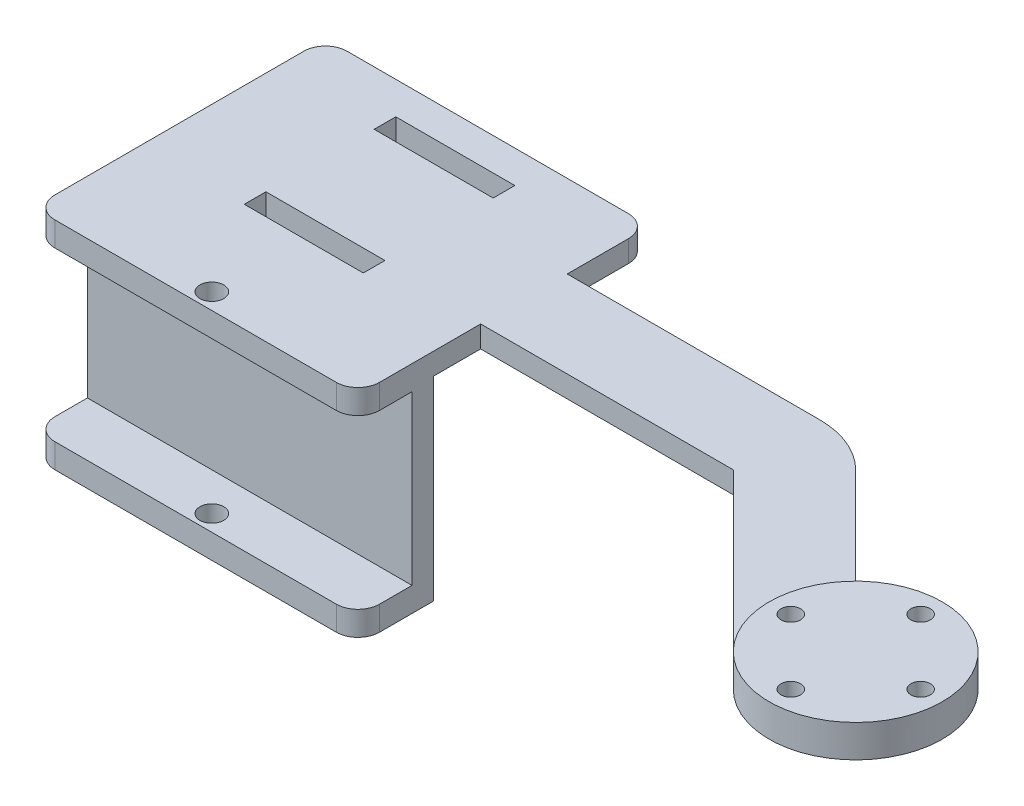
from build123d import *

# Parameters (mm, degrees)
SKETCH_1_W               = 30
SKETCH_1_H               = 7
EXTRUDE_1_DEPTH          = 20
SKETCH_2_W               = 30
SKETCH_2_H               = 15.5
CUT_EXTRUDE_1_DEPTH      = 5
CUT_EXTRUDE_2_DEPTH      = 37.728735344
CUT_EXTRUDE_2_DEPTH_BACK = 37.728735344
SKETCH_4_R               = 1.1
SKETCH_5_W               = 30
SKETCH_5_H               = 2
EXTRUDE_2_DEPTH          = 20
SKETCH_6_W               = 11
SKETCH_6_H               = 2
CUT_EXTRUDE_3_DEPTH      = 2
EXTRUDE_3_DEPTH          = 2
SKETCH_9_R               = 8
EXTRUDE_4_DEPTH          = 3
CUT_EXTRUDE_4_REACH      = 89.509
SKETCH_10_R              = 0.9
FILLET_1_R               = 2


with BuildPart() as part:
    # 草图1 → 凸台-拉伸1 (new body)
    with BuildSketch(Plane(origin=(0, 0, 0), x_dir=(1, 0, 0), z_dir=(0, 1, 0))):
        with Locations((15, -3.5)):
            Rectangle(SKETCH_1_W, SKETCH_1_H)
    extrude(amount=EXTRUDE_1_DEPTH)

    # 草图2 → 切除-拉伸1 (cut)
    with BuildSketch(Plane.XY.offset(7)):
        with Locations((15, 10)):
            Rectangle(SKETCH_2_W, SKETCH_2_H)
    extrude(amount=-CUT_EXTRUDE_1_DEPTH, mode=Mode.SUBTRACT)

    # 草图4 → 切除-拉伸2 (cut, two sides: drawn at the far end of the back side and taken through both)
    with BuildSketch(Plane(origin=(0, 20, 0), x_dir=(1, 0, 0), z_dir=(0, 1, 0)).offset(-CUT_EXTRUDE_2_DEPTH_BACK)):
        with Locations(Location((15, -5.5, 0), (0, 0, 270))):
            Circle(SKETCH_4_R)
    extrude(amount=CUT_EXTRUDE_2_DEPTH + CUT_EXTRUDE_2_DEPTH_BACK, mode=Mode.SUBTRACT)

    # 草图5 → 凸台-拉伸2 (add)
    with BuildSketch(Plane(origin=(0, 0, 0), x_dir=(-1, 0, 0), z_dir=(0, 0, -1))):
        with Locations((-15, 19)):
            Rectangle(SKETCH_5_W, SKETCH_5_H)
    extrude(amount=EXTRUDE_2_DEPTH)

    # 草图6 → 切除-拉伸3 (cut)
    with BuildSketch(Plane(origin=(0, 20, 0), x_dir=(1, 0, 0), z_dir=(0, 1, 0))):
        with Locations((15, 16)):
            Rectangle(SKETCH_6_W, SKETCH_6_H)
        with Locations((15, 4)):
            Rectangle(SKETCH_6_W, SKETCH_6_H)
    extrude(amount=-CUT_EXTRUDE_3_DEPTH, mode=Mode.SUBTRACT)

    # 草图7 → 凸台-拉伸3 (add)
    with BuildSketch(Plane.XZ.offset(-18)):
        with BuildLine():
            Line((30, -4.343145751), (30, -10))
            Line((30, -10), (30, -12.343145751))
            Line((30, -12.343145751), (53.343145751, -12.343145751))
            ThreePointArc((53.343145751, -12.343145751), (56.404613209, -11.734182011), (59, -10))
            Line((59, -10), (74.564382411, 5.564382411))
            Line((74.564382411, 5.564382411), (68.907528162, 11.221236661))
            Line((68.907528162, 11.221236661), (53.343145751, -4.343145751))
            Line((53.343145751, -4.343145751), (30, -4.343145751))
        make_face()
    extrude(amount=-EXTRUDE_3_DEPTH)

    # 草图9 → 凸台-拉伸4 (add)
    with BuildSketch(Plane.XZ.offset(-18)):
        with Locations(Location((74.564382411, 5.564382411, 0), (0, 0, 270))):
            Circle(SKETCH_9_R)
    extrude(amount=-EXTRUDE_4_DEPTH)

    # 草图10 → 切除-拉伸4 (cut, up to next)
    with BuildSketch(Plane(origin=(0, 21, 0), x_dir=(1, 0, 0), z_dir=(0, 1, 0)), mode=Mode.PRIVATE) as cut_extrude_4_sk1:
        with Locations(Location((68.564382411, -5.564382411, 0), (0, 0, 270))):
            Circle(SKETCH_10_R)
    cut_extrude_4_tool1 = extrude(cut_extrude_4_sk1.sketch, amount=-CUT_EXTRUDE_4_REACH, mode=Mode.PRIVATE) & part.part
    # 草图10 → 切除-拉伸4 (cut, up to next)
    with BuildSketch(Plane(origin=(0, 21, 0), x_dir=(1, 0, 0), z_dir=(0, 1, 0)), mode=Mode.PRIVATE) as cut_extrude_4_sk2:
        with Locations(Location((74.564382411, 0.435617589, 0), (0, 0, 270))):
            Circle(SKETCH_10_R)
    cut_extrude_4_tool2 = extrude(cut_extrude_4_sk2.sketch, amount=-CUT_EXTRUDE_4_REACH, mode=Mode.PRIVATE) & part.part
    # 草图10 → 切除-拉伸4 (cut, up to next)
    with BuildSketch(Plane(origin=(0, 21, 0), x_dir=(1, 0, 0), z_dir=(0, 1, 0)), mode=Mode.PRIVATE) as cut_extrude_4_sk3:
        with Locations(Location((80.564382411, -5.564382411, 0), (0, 0, 270))):
            Circle(SKETCH_10_R)
    cut_extrude_4_tool3 = extrude(cut_extrude_4_sk3.sketch, amount=-CUT_EXTRUDE_4_REACH, mode=Mode.PRIVATE) & part.part
    # 草图10 → 切除-拉伸4 (cut, up to next)
    with BuildSketch(Plane(origin=(0, 21, 0), x_dir=(1, 0, 0), z_dir=(0, 1, 0)), mode=Mode.PRIVATE) as cut_extrude_4_sk4:
        with Locations(Location((74.564382411, -11.564382411, 0), (0, 0, 270))):
            Circle(SKETCH_10_R)
    cut_extrude_4_tool4 = extrude(cut_extrude_4_sk4.sketch, amount=-CUT_EXTRUDE_4_REACH, mode=Mode.PRIVATE) & part.part
    add(cut_extrude_4_tool1.solids().sort_by_distance((68.564382, 21, 5.564382))[0], mode=Mode.SUBTRACT)
    add(cut_extrude_4_tool2.solids().sort_by_distance((74.564382, 21, -0.435618))[0], mode=Mode.SUBTRACT)
    add(cut_extrude_4_tool3.solids().sort_by_distance((80.564382, 21, 5.564382))[0], mode=Mode.SUBTRACT)
    add(cut_extrude_4_tool4.solids().sort_by_distance((74.564382, 21, 11.564382))[0], mode=Mode.SUBTRACT)

    # 圆角1
    fillet_1_edges = [part.edges().sort_by_distance(p)[0] for p in [
        (30, 1.125, 7),
        (0, 1.125, 7),
        (30, 19, -20),
        (0, 19, -20),
        (30, 18.875, 7),
        (0, 18.875, 7),
    ]]
    fillet(fillet_1_edges, radius=FILLET_1_R)


solid = part.part
